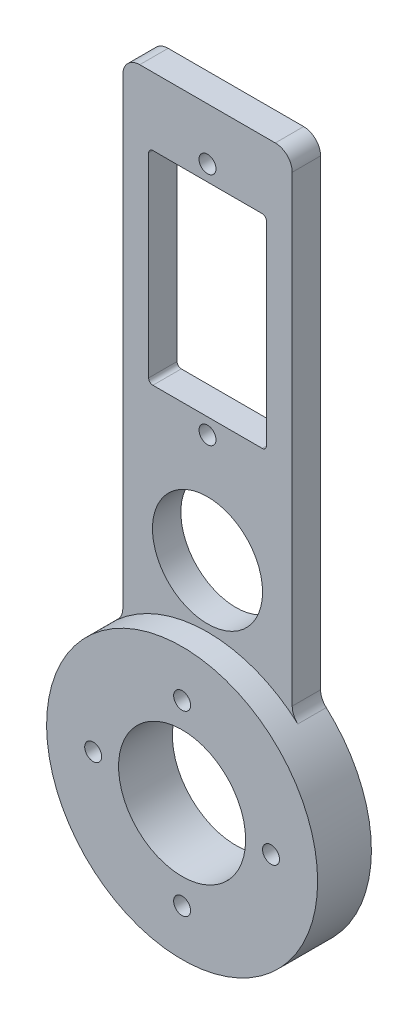
from build123d import *
from build123d.topology import SkipClean

# Parameters (mm, degrees)
SKETCH1_R           = 1
BOSS_EXTRUDE1_DEPTH = 6.35
SKETCH2_W           = 13.9
SKETCH2_H           = 24
SKETCH2_R           = 1
CUT_EXTRUDE1_DEPTH  = 73.085522125
FILLET1_R           = 0.5
FILLET2_R           = 2
SKETCH3_R           = 6.5
CUT_EXTRUDE2_DEPTH  = 6.35
SKETCH4_R           = 7.5
CUT_EXTRUDE3_DEPTH  = 73.085522125
SKETCH5_R           = 6.5
SKETCH5_R_2         = 1
CUT_EXTRUDE4_DEPTH  = 3


with BuildPart() as part:
    # Sketch1 → Boss-Extrude1 (new body)
    with BuildSketch(Plane.XY):
        with BuildLine():
            Line((-10, 12.489995997), (-10, 70))
            Line((-10, 70), (10, 70))
            Line((10, 70), (10, 12.489995997))
            ThreePointArc((10, 12.489995997), (0, -16), (-10, 12.489995997))
        make_face()
        with Locations((-10.5, 0)):
            Circle(SKETCH1_R, mode=Mode.SUBTRACT)
        with Locations((0, 10.5)):
            Circle(SKETCH1_R, mode=Mode.SUBTRACT)
        with Locations((10.5, 0)):
            Circle(SKETCH1_R, mode=Mode.SUBTRACT)
        with Locations((0, -10.5)):
            Circle(SKETCH1_R, mode=Mode.SUBTRACT)
    extrude(amount=BOSS_EXTRUDE1_DEPTH)

    # Sketch2 → Cut-Extrude1 (cut, through all)
    with BuildSketch(Plane.XY.offset(6.35)):
        with Locations((0, 50)):
            Rectangle(SKETCH2_W, SKETCH2_H)
        with Locations((0, 36.15)):
            Circle(SKETCH2_R)
        with Locations((0, 63.85)):
            Circle(SKETCH2_R)
    extrude(amount=-CUT_EXTRUDE1_DEPTH, mode=Mode.SUBTRACT)

    # Fillet1
    fillet1_edges = [part.edges().sort_by_distance(p)[0] for p in [
        (6.95, 62, 3.175),
        (6.95, 38, 3.175),
        (-6.95, 38, 3.175),
        (-6.95, 62, 3.175),
    ]]
    fillet(fillet1_edges, radius=FILLET1_R)

    # Fillet2
    fillet2_edges = [part.edges().sort_by_distance(p)[0] for p in [
        (-10, 12.489995997, 3.175),
        (10, 12.489995997, 3.175),
        (10, 70, 3.175),
        (-10, 70, 3.175),
    ]]
    fillet(fillet2_edges, radius=FILLET2_R)

    # Sketch3 → Cut-Extrude2 (cut)
    with BuildSketch(Plane.XY.offset(6.35)):
        with Locations((0, 23.325)):
            Circle(SKETCH3_R)
    extrude(amount=-CUT_EXTRUDE2_DEPTH, mode=Mode.SUBTRACT)

    # Sketch4 → Cut-Extrude3 (cut, through all)
    with BuildSketch(Plane.XY.offset(6.35)):
        Circle(SKETCH4_R)
    extrude(amount=-CUT_EXTRUDE3_DEPTH, mode=Mode.SUBTRACT)

    # Sketch5 → Cut-Extrude4 (cut)
    with SkipClean():  # the faces are left unmerged after this step: merging them gives an invalid solid
        with BuildSketch(Plane.XY.offset(6.35)):
            with BuildLine():
                ThreePointArc((10.666666667, 11.92569588), (10.174258142, 12.599911284), (10, 13.416407865))
                Line((10, 13.416407865), (10, 68))
                ThreePointArc((10, 68), (9.414213562, 69.414213562), (8, 70))
                Line((8, 70), (-8, 70))
                ThreePointArc((-8, 70), (-9.414213562, 69.414213562), (-10, 68))
                Line((-10, 68), (-10, 13.416407865))
                ThreePointArc((-10, 13.416407865), (-10.174258142, 12.599911284), (-10.666666667, 11.92569588))
                ThreePointArc((-10.666666667, 11.92569588), (0, 16), (10.666666667, 11.92569588))
            make_face()
            with Locations((0, 23.325)):
                Circle(SKETCH5_R, mode=Mode.SUBTRACT)
            with BuildLine():
                ThreePointArc((6.45, 62), (6.803553391, 61.853553391), (6.95, 61.5))
                Line((6.95, 61.5), (6.95, 38.5))
                ThreePointArc((6.95, 38.5), (6.803553391, 38.146446609), (6.45, 38))
                Line((6.45, 38), (-6.45, 38))
                ThreePointArc((-6.45, 38), (-6.803553391, 38.146446609), (-6.95, 38.5))
                Line((-6.95, 38.5), (-6.95, 61.5))
                ThreePointArc((-6.95, 61.5), (-6.803553391, 61.853553391), (-6.45, 62))
                Line((-6.45, 62), (6.45, 62))
            make_face(mode=Mode.SUBTRACT)
            with Locations((0, 36.15)):
                Circle(SKETCH5_R_2, mode=Mode.SUBTRACT)
            with Locations((0, 63.85)):
                Circle(SKETCH5_R_2, mode=Mode.SUBTRACT)
        extrude(amount=-CUT_EXTRUDE4_DEPTH, mode=Mode.SUBTRACT)


solid = part.part
